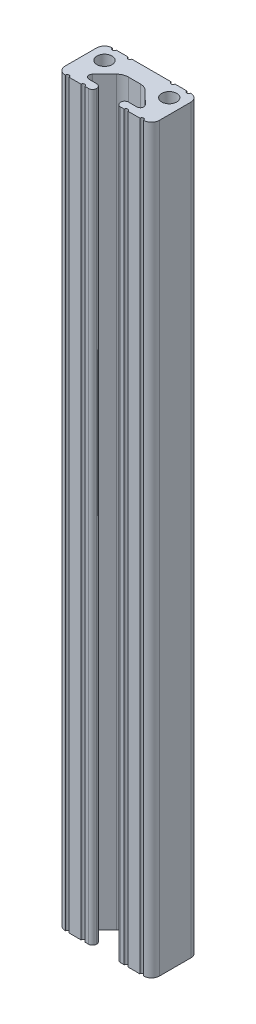
from build123d import *

# Parameters (mm, degrees)
SKETCH18_R                = 2.032
F_10_1050_PROFILE_1_DEPTH = 200


with BuildPart() as part:
    # Sketch18 → 10 1050 PROFILE(1) (new body)
    with BuildSketch(Plane.XZ.offset(-100)):
        with BuildLine():
            Line((9.551093887, 6.35), (6.330982008, 6.35))
            ThreePointArc((6.330982008, 6.35), (5.824379679, 5.843397671), (5.31777735, 6.35))
            Line((5.31777735, 6.35), (4.28752, 6.35))
            ThreePointArc((4.28752, 6.35), (3.545750844, 6.042749156), (3.2385, 5.30098))
            Line((3.2385, 5.30098), (3.2385, 5.18922))
            ThreePointArc((3.2385, 5.18922), (3.545750844, 4.447450844), (4.28752, 4.1402))
            Line((4.28752, 4.1402), (6.541264932, 4.1402))
            ThreePointArc((6.541264932, 4.1402), (7.403778411, 3.563601238), (7.200674335, 2.54618079))
            Line((7.200674335, 2.54618079), (3.874487735, -0.773919123))
            ThreePointArc((3.874487735, -0.773919123), (2.845157282, -1.460673567), (1.631480681, -1.7018))
            Line((1.631480681, -1.7018), (-1.631480681, -1.7018))
            ThreePointArc((-1.631480681, -1.7018), (-2.845157282, -1.460673567), (-3.874487735, -0.773919123))
            Line((-3.874487735, -0.773919123), (-7.091634343, 2.437340333))
            ThreePointArc((-7.091634343, 2.437340333), (-7.30860647, 3.524230776), (-6.387200124, 4.1402))
            Line((-6.387200124, 4.1402), (-4.28752, 4.1402))
            ThreePointArc((-4.28752, 4.1402), (-3.545750844, 4.447450844), (-3.2385, 5.18922))
            Line((-3.2385, 5.18922), (-3.2385, 5.30098))
            ThreePointArc((-3.2385, 5.30098), (-3.545750844, 6.042749156), (-4.28752, 6.35))
            Line((-4.28752, 6.35), (-5.319235427, 6.35))
            ThreePointArc((-5.319235427, 6.35), (-5.825837756, 5.843397671), (-6.332440085, 6.35))
            Line((-6.332440085, 6.35), (-9.552501021, 6.35))
            ThreePointArc((-9.552501021, 6.35), (-10.056951984, 5.843402239), (-10.565687406, 6.345697309))
            Line((-10.565687406, 6.345697309), (-10.591304516, 6.345701455))
            ThreePointArc((-10.591304516, 6.345701455), (-12.082359481, 5.728298321), (-12.7, 4.237343309))
            Line((-12.7, 4.237343309), (-12.7, -4.233074923))
            ThreePointArc((-12.7, -4.233074923), (-12.072915167, -5.733409532), (-10.564685825, -6.341261141))
            ThreePointArc((-10.564685825, -6.341261141), (-10.053713904, -5.834598435), (-9.551557924, -6.35))
            Line((-9.551557924, -6.35), (-6.323021107, -6.35))
            ThreePointArc((-6.323021107, -6.35), (-5.816495529, -5.83457959), (-5.309969951, -6.35))
            Line((-5.309969951, -6.35), (5.309969951, -6.35))
            ThreePointArc((5.309969951, -6.35), (5.816495529, -5.83457959), (6.323021107, -6.35))
            Line((6.323021107, -6.35), (9.550160942, -6.35))
            ThreePointArc((9.550160942, -6.35), (10.051855758, -5.834602622), (10.563288148, -6.340338775))
            Line((10.563288148, -6.340338775), (10.589922543, -6.34049468))
            ThreePointArc((10.589922543, -6.34049468), (12.081868228, -5.723579066), (12.7, -4.23213684))
            Line((12.7, -4.23213684), (12.7, 4.244714967))
            ThreePointArc((12.7, 4.244714967), (12.082266163, 5.735759476), (10.591047766, 6.353073372))
            Line((10.591047766, 6.353073372), (10.564289268, 6.353065837))
            ThreePointArc((10.564289268, 6.353065837), (10.059229141, 5.84339999), (9.551093887, 6.35))
        make_face()
        with Locations((-8.7376, -2.3876)):
            Circle(SKETCH18_R, mode=Mode.SUBTRACT)
        with Locations((8.7376, -2.3876)):
            Circle(SKETCH18_R, mode=Mode.SUBTRACT)
    extrude(amount=F_10_1050_PROFILE_1_DEPTH)


solid = part.part
